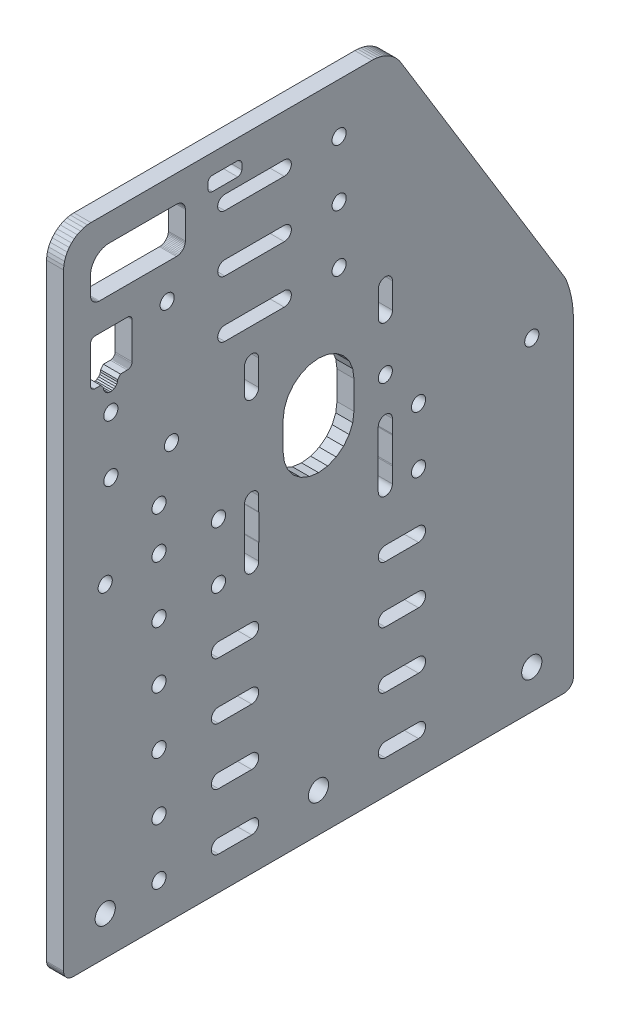
from build123d import *

# Parameters (mm, degrees)
SKETCH1_R           = 3.5685
SKETCH1_R_2         = 2.500000001
SKETCH1_R_3         = 2.5
BOSS_EXTRUDE1_DEPTH = 6
SKETCH2_R           = 2.500000001
SKETCH2_R_2         = 2.5
CUT_EXTRUDE3_DEPTH  = 1779.046328539


with BuildPart() as part:
    # Sketch1 → Boss-Extrude1 (new body)
    with BuildSketch(Plane(origin=(0, 0, 0), x_dir=(0, -1, 0), z_dir=(-1, 0, 0))):
        Polygon((-590.212112636, -1614.243728334), (-495.230350852, -1672.335619946), (-492.985489602, -1673.198794727), (-490.688058814, -1673.910331453), (-488.34828871, -1674.467061724), (-485.976598042, -1674.866506478), (-483.583547703, -1675.10688703), (-481.179793697, -1675.18713299), (-371.826596113, -1675.18713299), (-371.387664827, -1675.158363913), (-370.956243777, -1675.072548931), (-370.539714696, -1674.931156361), (-370.145204514, -1674.736605469), (-369.779463407, -1674.492225074), (-369.448749309, -1674.202196594), (-369.158720829, -1673.871482496), (-368.914340435, -1673.50574139), (-368.719789543, -1673.111231207), (-368.578396973, -1672.694702127), (-368.49258199, -1672.263281077), (-368.463812914, -1671.82434979), (-368.463812914, -1498.50991619), (-368.49258199, -1498.070984903), (-368.578396973, -1497.639563853), (-368.719789543, -1497.223034773), (-368.914340435, -1496.82852459), (-369.158720829, -1496.462783484), (-369.448749309, -1496.132069386), (-369.779463407, -1495.842040906), (-370.145204514, -1495.597660511), (-370.539714696, -1495.403109619), (-370.956243777, -1495.261717049), (-371.387664827, -1495.175902067), (-371.826596113, -1495.14713299), (-586.288106544, -1495.145619765), (-587.549717355, -1495.228301598), (-588.789742622, -1495.474950056), (-589.98696498, -1495.881344878), (-591.12089944, -1496.440532473), (-592.172143895, -1497.142944902), (-593.122711102, -1497.976563587), (-593.956336446, -1498.927124952), (-594.658756242, -1499.978364486), (-595.217951782, -1501.112295027), (-595.624354993, -1502.309514537), (-595.87101214, -1503.549538076), (-595.953702813, -1504.811148308), (-595.953702813, -1603.994310614), (-595.910202971, -1605.015955139), (-595.780018321, -1606.030204482), (-595.564091204, -1607.029716989), (-595.263984611, -1608.007257681), (-594.881870865, -1608.955750621), (-594.420515902, -1609.868330136), (-593.883259242, -1610.738390509), (-593.273989822, -1611.559633802), (-592.597117845, -1612.326115438), (-591.857542854, -1613.032287234), (-591.060618269, -1613.673037558), align=None)
        with Locations(Location((-382.159118976, -1509.84713299, 0), (0, 0, 90))):
            Circle(SKETCH1_R, mode=Mode.SUBTRACT)
        with Locations(Location((-382.159118976, -1585.16713299, 0), (0, 0, 90))):
            Circle(SKETCH1_R, mode=Mode.SUBTRACT)
        with Locations(Location((-382.159118976, -1660.48713299, 0), (0, 0, 90))):
            Circle(SKETCH1_R, mode=Mode.SUBTRACT)
        with Locations(Location((-538.399280751, -1592.457817223, 0), (0, 0, 90))):
            Circle(SKETCH1_R_2, mode=Mode.SUBTRACT)
        with Locations(Location((-558.44846865, -1592.457817223, 0), (0, 0, 90))):
            Circle(SKETCH1_R_2, mode=Mode.SUBTRACT)
        with Locations(Location((-578.44846865, -1592.457817223, 0), (0, 0, 90))):
            Circle(SKETCH1_R_2, mode=Mode.SUBTRACT)
        with Locations(Location((-534.443559506, -1511.847133017, 0), (0, 0, 90))):
            Circle(SKETCH1_R_2, mode=Mode.SUBTRACT)
        with Locations(Location((-558.402442437, -1531.722977175, 0), (0, 0, 90))):
            Circle(SKETCH1_R_2, mode=Mode.SUBTRACT)
        with Locations(Location((-514.443559639, -1511.847132679, 0), (0, 0, 90))):
            Circle(SKETCH1_R_2, mode=Mode.SUBTRACT)
        with Locations(Location((-514.443559639, -1533.238984755, 0), (0, 0, 90))):
            Circle(SKETCH1_R_2, mode=Mode.SUBTRACT)
        with Locations(Location((-497.496167838, -1528.847132988, 0), (0, 0, 90))):
            Circle(SKETCH1_R_3, mode=Mode.SUBTRACT)
        with Locations(Location((-482.799118976, -1549.84713299, 0), (0, 0, 90))):
            Circle(SKETCH1_R_2, mode=Mode.SUBTRACT)
        with Locations(Location((-482.799118976, -1509.84713299, 0), (0, 0, 90))):
            Circle(SKETCH1_R_2, mode=Mode.SUBTRACT)
        with Locations(Location((-482.799118976, -1620.48713299, 0), (0, 0, 90))):
            Circle(SKETCH1_R_2, mode=Mode.SUBTRACT)
        with Locations(Location((-482.799118977, -1660.487132991, 0), (0, 0, 90))):
            Circle(SKETCH1_R_2, mode=Mode.SUBTRACT)
        with Locations(Location((-402.49616799, -1528.847132989, 0), (0, 0, 90))):
            Circle(SKETCH1_R_2, mode=Mode.SUBTRACT)
        with BuildLine():
            Line((-575.977758464, -1552.084054241), (-575.977758464, -1573.056806032))
            ThreePointArc((-575.977758464, -1573.056806032), (-578.457148005, -1575.577342323), (-580.977684295, -1573.097952782))
            Line((-580.977684295, -1573.097952782), (-580.977684295, -1552.084054231))
            ThreePointArc((-580.977684295, -1552.084054231), (-578.477721375, -1549.570437307), (-575.977758464, -1552.084054241))
        make_face(mode=Mode.SUBTRACT)
        with BuildLine():
            Line((-535.977790671, -1552.085412401), (-535.977790671, -1573.058164192))
            ThreePointArc((-535.977790671, -1573.058164192), (-538.457180211, -1575.578700483), (-540.977716502, -1573.099310942))
            Line((-540.977716502, -1573.099310942), (-540.977716502, -1552.085412391))
            ThreePointArc((-540.977716502, -1552.085412391), (-538.477753581, -1549.571795467), (-535.977790671, -1552.085412401))
        make_face(mode=Mode.SUBTRACT)
        with BuildLine():
            Line((-555.97770846, -1552.099177314), (-555.97770846, -1573.085546029))
            ThreePointArc((-555.97770846, -1573.085546029), (-558.463906443, -1575.599273877), (-560.977634291, -1573.113075895))
            Line((-560.977634291, -1573.113075895), (-560.977634291, -1552.099177304))
            ThreePointArc((-560.977634291, -1552.099177304), (-558.47767137, -1549.58556036), (-555.97770846, -1552.099177314))
        make_face(mode=Mode.SUBTRACT)
        with BuildLine():
            Line((-524.913709892, -1559.055192962), (-515.913733671, -1559.055192962))
            ThreePointArc((-515.913733671, -1559.055192962), (-513.413733671, -1561.555192962), (-515.913733671, -1564.055192962))
            Line((-515.913733671, -1564.055192962), (-524.913709892, -1564.055192962))
            ThreePointArc((-524.913709892, -1564.055192962), (-527.413709892, -1561.555192962), (-524.913709892, -1559.055192962))
        make_face(mode=Mode.SUBTRACT)
        with BuildLine():
            Line((-524.913709892, -1606.299062763), (-515.913733671, -1606.299062763))
            ThreePointArc((-515.913733671, -1606.299062763), (-513.413733671, -1608.799062763), (-515.913733671, -1611.299062763))
            Line((-515.913733671, -1611.299062763), (-524.913709892, -1611.299062763))
            ThreePointArc((-524.913709892, -1611.299062763), (-527.413709892, -1608.799062763), (-524.913709892, -1606.299062763))
        make_face(mode=Mode.SUBTRACT)
        with BuildLine():
            Line((-477.66984009, -1606.299062763), (-468.669863869, -1606.299062763))
            ThreePointArc((-468.669863869, -1606.299062763), (-466.169863869, -1608.799062763), (-468.669863869, -1611.299062763))
            Line((-468.669863869, -1611.299062763), (-477.66984009, -1611.299062763))
            ThreePointArc((-477.66984009, -1611.299062763), (-480.16984009, -1608.799062763), (-477.66984009, -1606.299062763))
        make_face(mode=Mode.SUBTRACT)
        with BuildLine():
            Line((-477.669839463, -1559.052819647), (-468.669863869, -1559.055192962))
            ThreePointArc((-468.669863869, -1559.055192962), (-466.159015015, -1561.567366398), (-468.671188452, -1564.078215252))
            Line((-468.671188452, -1564.078215252), (-477.669845536, -1564.075842286))
            ThreePointArc((-477.669845536, -1564.075842286), (-480.18069465, -1561.564327931), (-477.669839463, -1559.052819647))
        make_face(mode=Mode.SUBTRACT)
        Polygon((-586.033555203, -1536.579108211), (-586.214987166, -1536.211200586), (-586.346845371, -1535.822758839), (-586.426873689, -1535.420429315), (-586.453702813, -1535.011095984), (-586.453702813, -1511.296236305), (-586.396818705, -1510.428352529), (-586.227139684, -1509.575318486), (-585.947569005, -1508.751729823), (-585.5628902, -1507.971678372), (-585.079685229, -1507.248511028), (-584.506221865, -1506.594601387), (-583.852312223, -1506.021138022), (-583.12914488, -1505.537933052), (-582.349093428, -1505.153254247), (-581.525504766, -1504.873683568), (-580.672470722, -1504.704004546), (-579.804586946, -1504.647120438), (-573.616888973, -1504.647120438), (-573.207555642, -1504.673949562), (-572.805226118, -1504.75397788), (-572.416784371, -1504.885836086), (-572.048876746, -1505.067268048), (-571.707798245, -1505.295169417), (-571.399384815, -1505.565640735), (-571.128913497, -1505.874054164), (-570.901012129, -1506.215132665), (-570.719580166, -1506.58304029), (-570.587721961, -1506.971482038), (-570.507693643, -1507.373811562), (-570.480864519, -1507.783144892), (-570.480864519, -1535.011095984), (-570.507693643, -1535.420429315), (-570.587721961, -1535.822758839), (-570.719580166, -1536.211200586), (-570.901012129, -1536.579108211), (-571.128913497, -1536.920186712), (-571.399384815, -1537.228600142), (-571.707798245, -1537.49907146), (-572.048876746, -1537.726972829), (-572.416784371, -1537.908404791), (-572.805226118, -1538.040262996), (-573.207555642, -1538.120291315), (-573.616888973, -1538.147120438), (-583.317678359, -1538.147120438), (-583.72701169, -1538.120291315), (-584.129341214, -1538.040262996), (-584.517782961, -1537.908404791), (-584.885690586, -1537.726972828), (-585.226769087, -1537.49907146), (-585.535182516, -1537.228600142), (-585.805653835, -1536.920186712), align=None, mode=Mode.SUBTRACT)
        Polygon((-560.539732338, -1505.878268758), (-560.469558584, -1505.671543545), (-560.373002121, -1505.475746407), (-560.251715057, -1505.294227488), (-560.107772647, -1505.130092628), (-559.943637786, -1504.986150218), (-559.762118868, -1504.864863154), (-559.56632173, -1504.768306692), (-559.359596516, -1504.698132938), (-559.131202133, -1504.647120439), (-558.927636825, -1504.641264366), (-548.4808636, -1504.645157132), (-545.881846575, -1504.645157132), (-545.667730411, -1504.687747485), (-545.461005198, -1504.757921239), (-545.26520806, -1504.854477702), (-545.083689141, -1504.975764766), (-544.919554281, -1505.119707176), (-544.775611871, -1505.283842037), (-544.654324807, -1505.465360956), (-544.557768345, -1505.661158094), (-544.487594591, -1505.867883307), (-544.445004238, -1506.081999471), (-544.441434684, -1508.267709423), (-543.221041992, -1509.237688263), (-542.573960137, -1509.322613597), (-541.970907354, -1509.572122279), (-541.452980696, -1509.969210703), (-541.055476008, -1510.486817951), (-540.805482577, -1511.089669943), (-540.720037042, -1511.736683313), (-540.804962376, -1512.383765169), (-541.054471058, -1512.986817951), (-541.451559482, -1513.504744609), (-541.96916673, -1513.902249297), (-542.572018722, -1514.152242729), (-543.219032092, -1514.237688263), (-544.432285676, -1515.207667102), (-544.430726027, -1517.677645941), (-544.487594599, -1518.109605632), (-544.557768353, -1518.316330846), (-544.654324816, -1518.512127983), (-544.77561188, -1518.693646902), (-544.91955429, -1518.857781763), (-545.083689151, -1519.001724172), (-545.26520807, -1519.123011236), (-545.461005208, -1519.219567699), (-545.667730421, -1519.289741453), (-546.099691027, -1519.348570172), (-558.957839921, -1519.342717258), (-559.145480362, -1519.342717258), (-559.359596526, -1519.300126905), (-559.566321739, -1519.229953151), (-559.762118877, -1519.133396688), (-559.943637796, -1519.012109624), (-560.107772656, -1518.868167214), (-560.251715066, -1518.704032353), (-560.37300213, -1518.522513435), (-560.469558592, -1518.326716297), (-560.539732347, -1518.119991083), (-560.582322699, -1517.905874919), (-560.582322699, -1517.679609247), (-560.568044472, -1506.083962777), align=None, mode=Mode.SUBTRACT)
        Polygon((-512.609294248, -1578.937135138), (-510.622811466, -1576.348300373), (-508.033976701, -1574.36181759), (-505.019214764, -1573.113062308), (-501.7839767, -1572.687135137), (-491.783976402, -1572.687135137), (-488.548738338, -1573.113062308), (-485.533976401, -1574.36181759), (-482.945141636, -1576.348300373), (-480.958658854, -1578.937135138), (-479.709903572, -1581.951897074), (-479.283976401, -1585.187135138), (-479.709903572, -1588.422373202), (-480.958658854, -1591.437135139), (-482.945141636, -1594.025969904), (-485.533976401, -1596.012452687), (-488.548738338, -1597.261207968), (-491.783976402, -1597.68713514), (-501.7839767, -1597.68713514), (-505.019214764, -1597.261207968), (-508.033976701, -1596.012452687), (-510.622811466, -1594.025969904), (-512.609294248, -1591.437135139), (-513.85804953, -1588.422373202), (-514.283976701, -1585.187135138), (-513.85804953, -1581.951897074), align=None, mode=Mode.SUBTRACT)
        with BuildLine():
            Line((-588.98086362, -1556.648178727), (-588.98086362, -1547.550419842))
            ThreePointArc((-588.98086362, -1547.550419842), (-588.50376059, -1546.590680791), (-587.544021697, -1546.113577446))
            Line((-587.544021697, -1546.113577446), (-585.643575513, -1546.099299227))
            ThreePointArc((-585.643575513, -1546.099299227), (-584.463439705, -1546.588127429), (-583.974611428, -1547.768263206))
            Line((-583.974611428, -1547.768263206), (-583.988889647, -1556.648178564))
            ThreePointArc((-583.988889647, -1556.648178564), (-584.465992569, -1557.607917612), (-585.425731394, -1558.085020984))
            Line((-585.425731394, -1558.085020984), (-587.544021696, -1558.085020984))
            ThreePointArc((-587.544021696, -1558.085020984), (-588.506313615, -1557.610470755), (-588.98086362, -1556.648178727))
        make_face(mode=Mode.SUBTRACT)
    extrude(amount=-BOSS_EXTRUDE1_DEPTH)

    # Sketch2 → Cut-Extrude3 (cut, through all)
    with BuildSketch(Plane(origin=(6, 0, 0), x_dir=(0, 0, -1), z_dir=(1, 0, 0))):
        with BuildLine():
            Line((1606.267132989, 482.799118976), (1606.267132989, 462.799118976))
            ThreePointArc((1606.267132989, 462.799118976), (1608.76713299, 460.299118975), (1611.267132991, 462.799118976))
            Line((1611.267132991, 462.799118976), (1611.267132991, 482.799118976))
            ThreePointArc((1611.267132991, 482.799118976), (1608.76713299, 485.299118977), (1606.267132989, 482.799118976))
        make_face()
        with Locations((1549.84713299, 442.799118976)):
            Circle(SKETCH2_R)
        with Locations(Location((1549.84713299, 482.799118976, 0), (0, 0, 180))):
            Circle(SKETCH2_R)
        with Locations((1549.84713299, 462.799118976)):
            Circle(SKETCH2_R)
        with Locations((1549.84713299, 422.799118976)):
            Circle(SKETCH2_R)
        with Locations((1549.84713299, 402.799118976)):
            Circle(SKETCH2_R)
        with Locations((1549.84713299, 382.799118976)):
            Circle(SKETCH2_R)
        with Locations((1561.56713299, 382.799118976)):
            Circle(SKETCH2_R)
        with Locations((1561.56713299, 402.799118976)):
            Circle(SKETCH2_R)
        with Locations((1561.56713299, 422.799118976)):
            Circle(SKETCH2_R)
        with Locations((1561.56713299, 442.799118976)):
            Circle(SKETCH2_R)
        with BuildLine():
            Line((1564.067132991, 482.799118976), (1564.067132991, 462.799118976))
            ThreePointArc((1564.067132991, 462.799118976), (1561.56713299, 460.299118975), (1559.067132989, 462.799118976))
            Line((1559.067132989, 462.799118976), (1559.067132989, 482.799118976))
            ThreePointArc((1559.067132989, 482.799118976), (1561.56713299, 485.299118977), (1564.067132991, 482.799118976))
        make_face()
        with Locations((1620.48713299, 462.799118976)):
            Circle(SKETCH2_R)
        with Locations((1608.76713299, 402.799118976)):
            Circle(SKETCH2_R)
        with Locations((1608.76713299, 382.799118976)):
            Circle(SKETCH2_R)
        with Locations((1620.48713299, 382.799118976)):
            Circle(SKETCH2_R)
        with Locations((1620.48713299, 402.799118976)):
            Circle(SKETCH2_R)
        with Locations((1620.48713299, 422.799118976)):
            Circle(SKETCH2_R)
        with Locations((1608.76713299, 422.799118976)):
            Circle(SKETCH2_R)
        with Locations((1608.76713299, 442.799118976)):
            Circle(SKETCH2_R)
        with Locations((1620.48713299, 442.799118976)):
            Circle(SKETCH2_R)
        with Locations(Location((1620.48713299, 482.799118976, 0), (0, 0, 180))):
            Circle(SKETCH2_R)
        with Locations((1608.767132988, 497.496167838)):
            Circle(SKETCH2_R_2)
        with Locations((1528.847132988, 382.745908718)):
            Circle(SKETCH2_R_2)
        with Locations((1528.847132988, 462.786116014)):
            Circle(SKETCH2_R_2)
        with Locations((1528.847132988, 442.77606419)):
            Circle(SKETCH2_R_2)
        with Locations((1528.847132988, 482.796167838)):
            Circle(SKETCH2_R_2)
        with Locations((1528.847132988, 422.766012366)):
            Circle(SKETCH2_R_2)
        with BuildLine():
            Line((1620.48713299, 445.299118976), (1608.76713299, 445.299118976))
            ThreePointArc((1608.76713299, 445.299118976), (1606.26713299, 442.799118976), (1608.76713299, 440.299118976))
            Line((1608.76713299, 440.299118976), (1620.48713299, 440.299118976))
            ThreePointArc((1620.48713299, 440.299118976), (1622.98713299, 442.799118976), (1620.48713299, 445.299118976))
        make_face()
        with BuildLine():
            Line((1620.48713299, 425.299118976), (1608.76713299, 425.299118976))
            ThreePointArc((1608.76713299, 425.299118976), (1606.26713299, 422.799118976), (1608.76713299, 420.299118976))
            Line((1608.76713299, 420.299118976), (1620.48713299, 420.299118976))
            ThreePointArc((1620.48713299, 420.299118976), (1622.98713299, 422.799118976), (1620.48713299, 425.299118976))
        make_face()
        with BuildLine():
            Line((1620.48713299, 405.299118976), (1608.76713299, 405.299118976))
            ThreePointArc((1608.76713299, 405.299118976), (1606.26713299, 402.799118976), (1608.76713299, 400.299118976))
            Line((1608.76713299, 400.299118976), (1620.48713299, 400.299118976))
            ThreePointArc((1620.48713299, 400.299118976), (1622.98713299, 402.799118976), (1620.48713299, 405.299118976))
        make_face()
        with BuildLine():
            Line((1620.48713299, 385.299118976), (1608.76713299, 385.299118976))
            ThreePointArc((1608.76713299, 385.299118976), (1606.26713299, 382.799118976), (1608.76713299, 380.299118976))
            Line((1608.76713299, 380.299118976), (1620.48713299, 380.299118976))
            ThreePointArc((1620.48713299, 380.299118976), (1622.98713299, 382.799118976), (1620.48713299, 385.299118976))
        make_face()
        with BuildLine():
            Line((1561.56713299, 385.299118976), (1549.84713299, 385.299118976))
            ThreePointArc((1549.84713299, 385.299118976), (1547.34713299, 382.799118976), (1549.84713299, 380.299118976))
            Line((1549.84713299, 380.299118976), (1561.56713299, 380.299118976))
            ThreePointArc((1561.56713299, 380.299118976), (1564.06713299, 382.799118976), (1561.56713299, 385.299118976))
        make_face()
        with BuildLine():
            Line((1561.56713299, 405.299118976), (1549.84713299, 405.299118976))
            ThreePointArc((1549.84713299, 405.299118976), (1547.34713299, 402.799118976), (1549.84713299, 400.299118976))
            Line((1549.84713299, 400.299118976), (1561.56713299, 400.299118976))
            ThreePointArc((1561.56713299, 400.299118976), (1564.06713299, 402.799118976), (1561.56713299, 405.299118976))
        make_face()
        with BuildLine():
            Line((1561.56713299, 425.299118976), (1549.84713299, 425.299118976))
            ThreePointArc((1549.84713299, 425.299118976), (1547.34713299, 422.799118976), (1549.84713299, 420.299118976))
            Line((1549.84713299, 420.299118976), (1561.56713299, 420.299118976))
            ThreePointArc((1561.56713299, 420.299118976), (1564.06713299, 422.799118976), (1561.56713299, 425.299118976))
        make_face()
        with BuildLine():
            Line((1561.56713299, 445.299118976), (1549.84713299, 445.299118976))
            ThreePointArc((1549.84713299, 445.299118976), (1547.34713299, 442.799118976), (1549.84713299, 440.299118976))
            Line((1549.84713299, 440.299118976), (1561.56713299, 440.299118976))
            ThreePointArc((1561.56713299, 440.299118976), (1564.06713299, 442.799118976), (1561.56713299, 445.299118976))
        make_face()
    extrude(amount=-CUT_EXTRUDE3_DEPTH, mode=Mode.SUBTRACT)


solid = part.part
